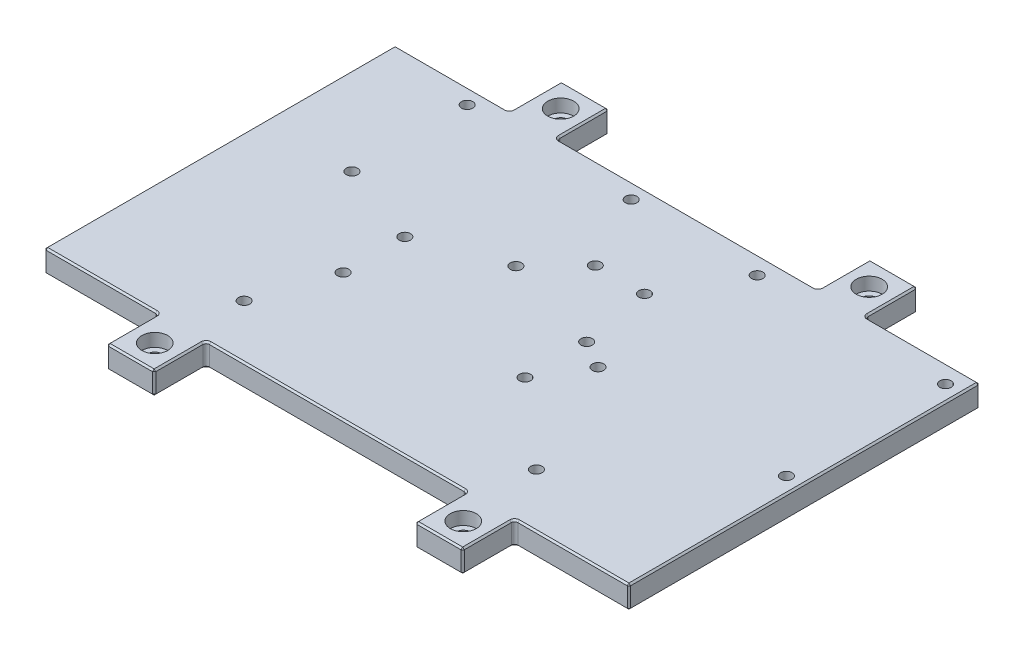
from build123d import *

# Parameters (mm, degrees)
BOSS_EXTRUDE1_DEPTH            = 7
SKETCH3_R                      = 1.75
CUT_EXTRUDE1_DEPTH             = 124.269646737
CBORE_FOR_M4_SHCS1_D           = 4.5
CBORE_FOR_M4_SHCS1_CBORE_D     = 8
CBORE_FOR_M4_SHCS1_CBORE_DEPTH = 4
FILLET1_R                      = 1
CHAMFER2_SIZE                  = 0.5


with BuildPart() as part:
    # Sketch1 → Boss-Extrude1 (new body)
    with BuildSketch(Plane(origin=(0, 0, 0), x_dir=(1, 0, 0), z_dir=(0, 1, 0))):
        Polygon((43.575468355, 54), (43.575468355, 70), (28.975468355, 70), (28.975468355, 54), (-51.424531645, 54), (-51.424531645, 70), (-66.024531645, 70), (-66.024531645, 54), (-101.224531645, 54), (-101.224531645, -54), (-66.024531645, -54), (-66.024531645, -70), (-51.424531645, -70), (-51.424531645, -54), (28.975468355, -54), (28.975468355, -70), (43.575468355, -70), (43.575468355, -54), (78.775468355, -54), (78.775468355, 54), align=None)
    extrude(amount=BOSS_EXTRUDE1_DEPTH)

    # Sketch3 → Cut-Extrude1 (cut, through all)
    with BuildSketch(Plane.XZ):
        with Locations(Location((33.775468355, 37.5, 0), (0, 0, 270))):
            Circle(SKETCH3_R)
        with Locations(Location((-56.224531645, 37.5, 0), (0, 0, 270))):
            Circle(SKETCH3_R)
        with Locations(Location((73.975468355, 0.7, 0), (0, 0, 270))):
            Circle(SKETCH3_R)
        with Locations(Location((73.975468355, -48.3, 0), (0, 0, 270))):
            Circle(SKETCH3_R)
        with Locations(Location((15.975468355, -48.3, 0), (0, 0, 270))):
            Circle(SKETCH3_R)
        with Locations(Location((15.975468355, 0.7, 0), (0, 0, 270))):
            Circle(SKETCH3_R)
        with Locations(Location((-48.524531645, -4.3, 0), (0, 0, 270))):
            Circle(SKETCH3_R)
        with Locations(Location((-48.524531645, 14.7, 0), (0, 0, 270))):
            Circle(SKETCH3_R)
        with Locations(Location((7.475468355, 14.7, 0), (0, 0, 270))):
            Circle(SKETCH3_R)
        with Locations(Location((7.475468355, -4.3, 0), (0, 0, 270))):
            Circle(SKETCH3_R)
        with Locations(Location((-23.624531645, -13.6, 0), (0, 0, 270))):
            Circle(SKETCH3_R)
        with Locations(Location((-23.624531645, -49.1, 0), (0, 0, 270))):
            Circle(SKETCH3_R)
        with Locations(Location((-74.124531645, -49.1, 0), (0, 0, 270))):
            Circle(SKETCH3_R)
        with Locations(Location((-74.124531645, -13.6, 0), (0, 0, 270))):
            Circle(SKETCH3_R)
        with Locations(Location((-11.574531645, -26, 0), (0, 0, 270))):
            Circle(SKETCH3_R)
        with Locations(Location((3.575468355, -26, 0), (0, 0, 270))):
            Circle(SKETCH3_R)
    extrude(amount=-CUT_EXTRUDE1_DEPTH, mode=Mode.SUBTRACT)

    # CBORE for M4 SHCS1 (through all)
    with Locations(Plane(origin=(0, 7, 0), x_dir=(1, 0, 0), z_dir=(0, 1, 0))):
        with Locations((-58.724531645, 62.5), (36.275468355, 62.5), (36.275468355, -62.5), (-58.724531645, -62.5)):
            CounterBoreHole(CBORE_FOR_M4_SHCS1_D / 2, CBORE_FOR_M4_SHCS1_CBORE_D / 2, CBORE_FOR_M4_SHCS1_CBORE_DEPTH)

    # Fillet1
    fillet1_edges = [part.edges().sort_by_distance(p)[0] for p in [
        (-66.024531645, 3.5, -54),
        (-51.424531645, 3.5, -54),
        (28.975468355, 3.5, -54),
        (43.575468355, 3.5, -54),
        (43.575468355, 3.5, 54),
        (28.975468355, 3.5, 54),
        (-51.424531645, 3.5, 54),
        (-66.024531645, 3.5, 54),
    ]]
    fillet(fillet1_edges, radius=FILLET1_R)

    # Chamfer2
    chamfer2_edges = [part.edges().sort_by_distance(p)[0] for p in [
        (-84.124531645, 0, -54),
        (-66.024531645, 0, -62.5),
        (-66.024531645, 7, 62.5),
        (-84.124531645, 7, 54),
        (-58.724531645, 0, -70),
        (-11.224531645, 7, 54),
        (-11.224531645, 0, 54),
        (-51.424531645, 0, 62.5),
        (28.975468355, 7, 62.5),
        (61.675468355, 0, 54),
        (43.575468355, 0, 62.5),
        (43.575468355, 0, -62.5),
        (61.675468355, 0, -54),
        (-11.224531645, 7, -54),
        (-11.224531645, 0, -54),
        (28.975468355, 0, -62.5),
        (28.975468355, 7, -62.5),
        (-84.124531645, 7, -54),
        (-66.024531645, 7, -62.5),
        (36.275468355, 0, -70),
        (-51.424531645, 0, -62.5),
        (-66.317424864, 0, 54.292893219),
        (-66.317424864, 7, 54.292893219),
        (-51.131638426, 0, 54.292893219),
        (-51.131638426, 7, 54.292893219),
        (28.682575136, 0, 54.292893219),
        (28.682575136, 7, 54.292893219),
        (43.868361574, 0, 54.292893219),
        (43.868361574, 7, 54.292893219),
        (43.868361574, 0, -54.292893219),
        (43.868361574, 7, -54.292893219),
        (28.682575136, 0, -54.292893219),
        (28.682575136, 7, -54.292893219),
        (-66.317424864, 0, -54.292893219),
        (-66.317424864, 7, -54.292893219),
        (-51.131638426, 0, -54.292893219),
        (-51.131638426, 7, -54.292893219),
        (78.775468355, 0, 0),
        (36.275468355, 0, 70),
        (28.975468355, 0, 62.5),
        (-58.724531645, 0, 70),
        (-66.024531645, 0, 62.5),
        (-84.124531645, 0, 54),
        (-101.224531645, 0, 0),
        (-101.224531645, 3.5, -54),
        (-66.024531645, 3.5, -70),
        (-51.424531645, 3.5, -70),
        (-58.724531645, 7, -70),
        (-51.424531645, 7, -62.5),
        (28.975468355, 3.5, -70),
        (43.575468355, 3.5, -70),
        (36.275468355, 7, -70),
        (43.575468355, 7, -62.5),
        (78.775468355, 3.5, -54),
        (61.675468355, 7, -54),
        (78.775468355, 3.5, 54),
        (78.775468355, 7, 0),
        (61.675468355, 7, 54),
        (43.575468355, 3.5, 70),
        (43.575468355, 7, 62.5),
        (28.975468355, 3.5, 70),
        (36.275468355, 7, 70),
        (-51.424531645, 3.5, 70),
        (-51.424531645, 7, 62.5),
        (-66.024531645, 3.5, 70),
        (-58.724531645, 7, 70),
        (-101.224531645, 3.5, 54),
        (-101.224531645, 7, 0),
    ]]
    chamfer(chamfer2_edges, length=CHAMFER2_SIZE)


solid = part.part
